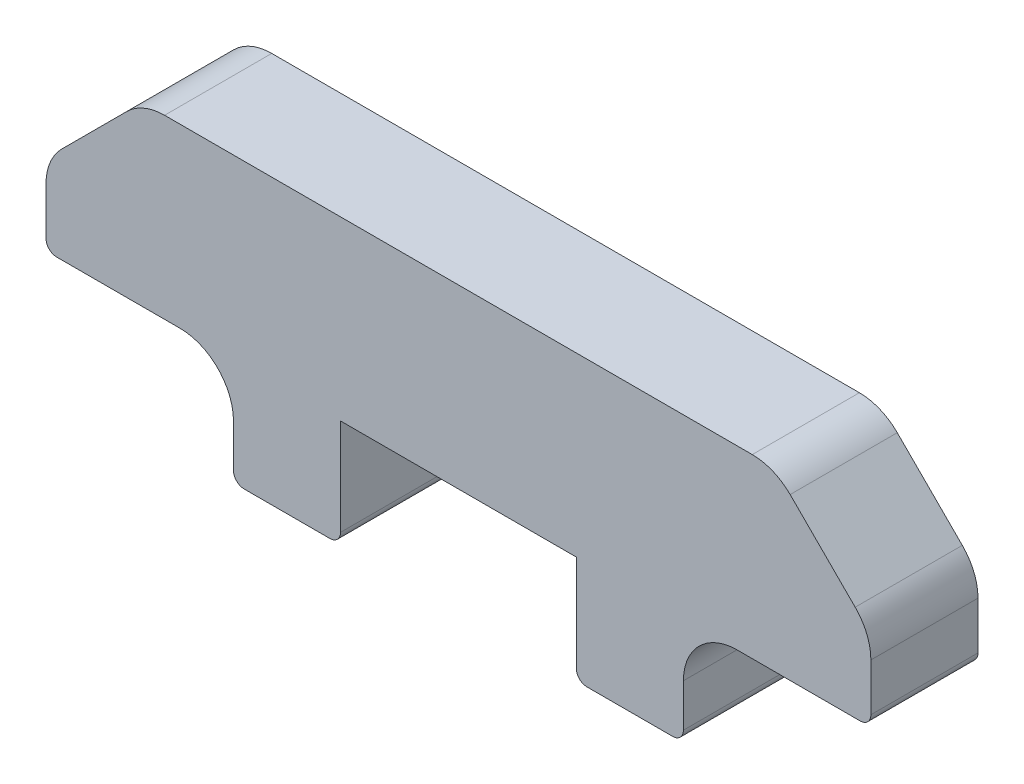
from build123d import *

# Parameters (mm, degrees)
BOSS_EXTRUDE1_DEPTH = 20


with BuildPart() as part:
    # Sketch1 → Boss-Extrude1 (new body)
    with BuildSketch(Plane.XY):
        with BuildLine():
            Line((22, 0), (-22, 0))
            Line((-22, 0), (-22, -18))
            ThreePointArc((-22, -18), (-22.585786438, -19.414213562), (-24, -20))
            Line((-24, -20), (-40, -20))
            ThreePointArc((-40, -20), (-41.414213562, -19.414213562), (-42, -18))
            Line((-42, -18), (-42, -10))
            ThreePointArc((-42, -10), (-44.928932188, -2.928932188), (-52, 0))
            Line((-52, 0), (-75, 0))
            ThreePointArc((-75, 0), (-76.414213562, 0.585786438), (-77, 2))
            Line((-77, 2), (-77, 10.857864376))
            ThreePointArc((-77, 10.857864376), (-76.238795325, 14.6846987), (-74.071067812, 17.928932188))
            Line((-74.071067812, 17.928932188), (-61.928932188, 30.071067812))
            ThreePointArc((-61.928932188, 30.071067812), (-58.6846987, 32.238795325), (-54.857864376, 33))
            Line((-54.857864376, 33), (54.857864376, 33))
            ThreePointArc((54.857864376, 33), (58.6846987, 32.238795325), (61.928932188, 30.071067812))
            Line((61.928932188, 30.071067812), (74.071067812, 17.928932188))
            ThreePointArc((74.071067812, 17.928932188), (76.238795325, 14.6846987), (77, 10.857864376))
            Line((77, 10.857864376), (77, 2))
            ThreePointArc((77, 2), (76.414213562, 0.585786438), (75, 0))
            Line((75, 0), (52, 0))
            ThreePointArc((52, 0), (44.928932188, -2.928932188), (42, -10))
            Line((42, -10), (42, -18))
            ThreePointArc((42, -18), (41.414213562, -19.414213562), (40, -20))
            Line((40, -20), (24, -20))
            ThreePointArc((24, -20), (22.585786438, -19.414213562), (22, -18))
            Line((22, -18), (22, 0))
        make_face()
    extrude(amount=BOSS_EXTRUDE1_DEPTH)


solid = part.part
